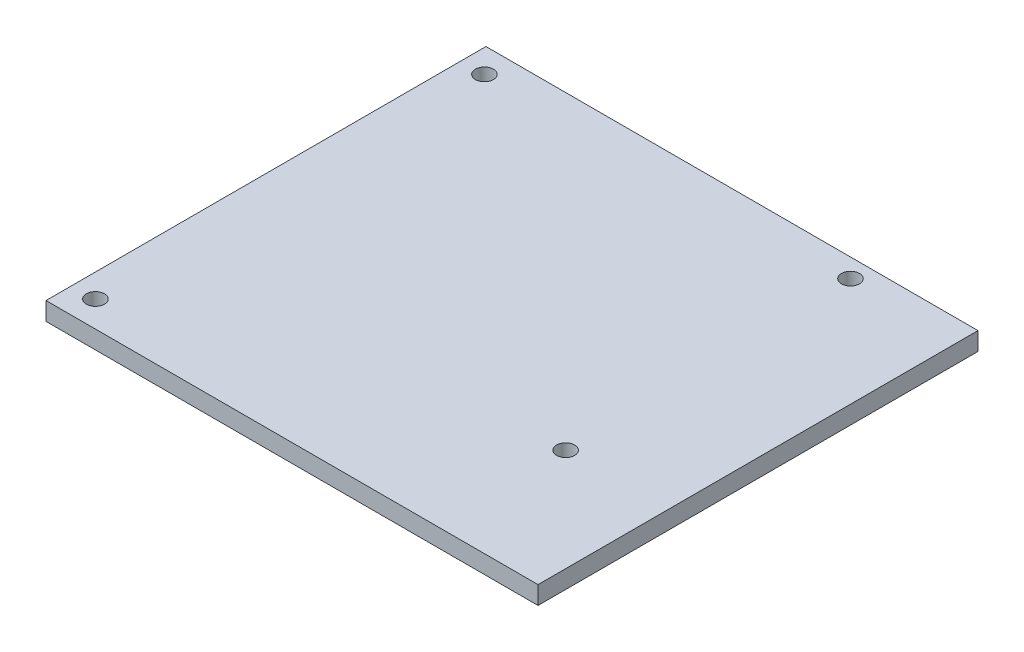
from build123d import *

# Parameters (mm, degrees)
SKETCH_1_W      = 81.597
SKETCH_1_H      = 72.962
SKETCH_1_R      = 1.5
EXTRUDE_1_DEPTH = 3


with BuildPart() as part:
    # 草图1 → 凸台-拉伸1 (new body)
    with BuildSketch(Plane(origin=(0, 0, 0), x_dir=(1, 0, 0), z_dir=(0, 1, 0))):
        with Locations((33.6225, 19.971)):
            Rectangle(SKETCH_1_W, SKETCH_1_H)
        with Locations(Location((-3.302, -12.192, 0), (0, 0, 270))):
            Circle(SKETCH_1_R, mode=Mode.SUBTRACT)
        with Locations(Location((-3.302, 52.324, 0), (0, 0, 270))):
            Circle(SKETCH_1_R, mode=Mode.SUBTRACT)
        with Locations(Location((56.388, 53.34, 0), (0, 0, 270))):
            Circle(SKETCH_1_R, mode=Mode.SUBTRACT)
        with Locations(Location((57.404, 5.08, 0), (0, 0, 270))):
            Circle(SKETCH_1_R, mode=Mode.SUBTRACT)
    extrude(amount=EXTRUDE_1_DEPTH)


solid = part.part
